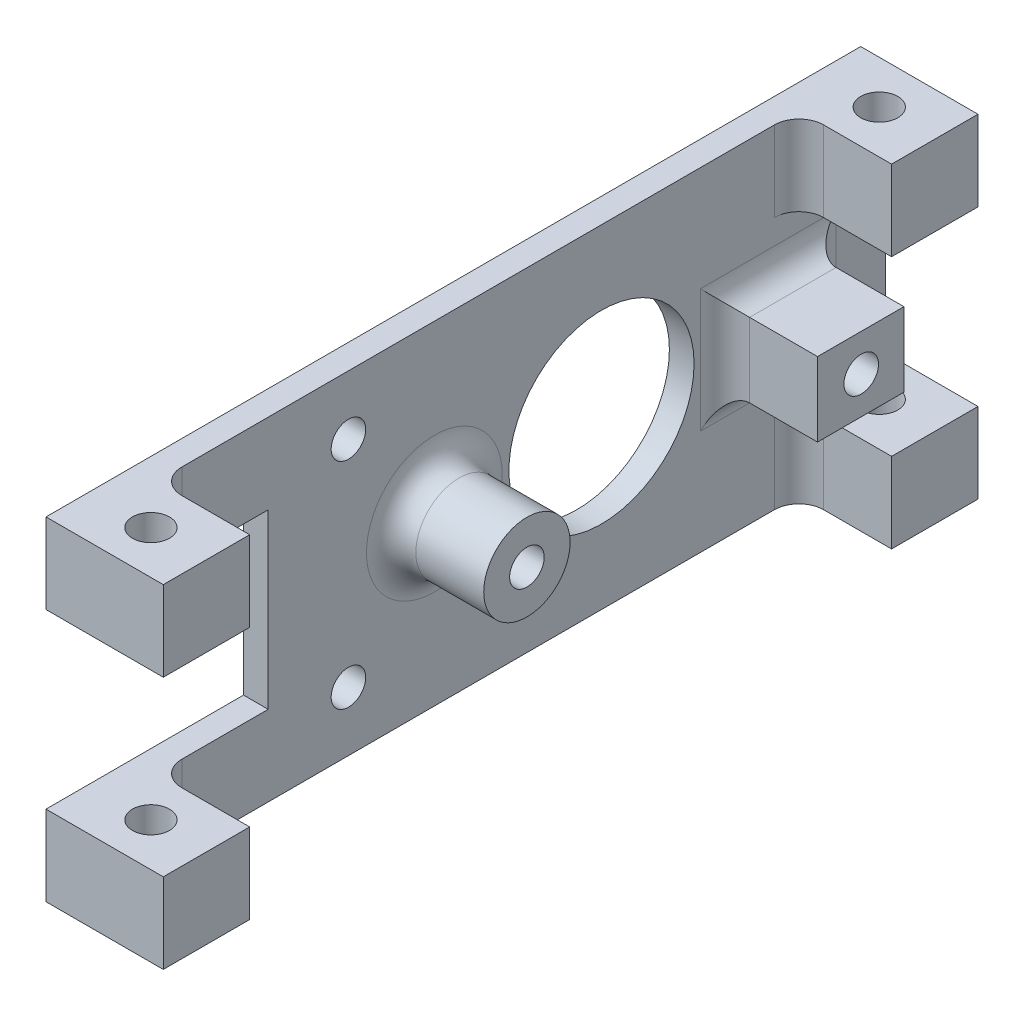
from build123d import *

# Parameters (mm, degrees)
SKETCH1_W           = 66
SKETCH1_H           = 27
BOSS_EXTRUDE1_DEPTH = 2
SKETCH2_R           = 7.5
CUT_EXTRUDE1_DEPTH  = 2
BOSS_EXTRUDE2_DEPTH = 7.5
SKETCH4_R           = 1.5
CUT_EXTRUDE2_DEPTH  = 31
SKETCH5_R           = 1.4
CUT_EXTRUDE3_DEPTH  = 31
SKETCH6_W           = 7
SKETCH6_H           = 27
BOSS_EXTRUDE3_DEPTH = 7.5
SKETCH7_R           = 1.5
CUT_EXTRUDE4_DEPTH  = 33.5
SKETCH8_W           = 16
SKETCH8_H           = 14
CUT_EXTRUDE5_DEPTH  = 15.75
SKETCH9_R           = 1.4
CUT_EXTRUDE6_DEPTH  = 31.5
SKETCH10_R          = 3.5
BOSS_EXTRUDE4_DEPTH = 7.5
SKETCH11_R          = 1.4
CUT_EXTRUDE7_DEPTH  = 9.5
CUT_EXTRUDE8_DEPTH  = 7.5
FILLET1_R           = 2


with BuildPart() as part:
    # Sketch1 → Boss-Extrude1 (new body)
    with BuildSketch(Plane(origin=(0, 0, 0), x_dir=(0, 0, -1), z_dir=(1, 0, 0))):
        Rectangle(SKETCH1_W, SKETCH1_H)
    extrude(amount=BOSS_EXTRUDE1_DEPTH)

    # Sketch2 → Cut-Extrude1 (cut)
    with BuildSketch(Plane(origin=(2, 0, 0), x_dir=(0, 0, -1), z_dir=(1, 0, 0))):
        with Locations((10, 0)):
            Circle(SKETCH2_R)
    extrude(amount=-CUT_EXTRUDE1_DEPTH, mode=Mode.SUBTRACT)

    # Sketch3 → Boss-Extrude2 (add)
    with BuildSketch(Plane(origin=(2, 0, 0), x_dir=(0, 0, -1), z_dir=(1, 0, 0))):
        Polygon((33, 13.5), (26, 13.5), (26, 3), (20, 3), (20, -3), (26, -3), (26, -13.5), (33, -13.5), align=None)
    extrude(amount=BOSS_EXTRUDE2_DEPTH)

    # Sketch4 → Cut-Extrude2 (cut)
    with BuildSketch(Plane(origin=(0, 13.5, 0), x_dir=(1, 0, 0), z_dir=(0, 1, 0))):
        with Locations(Location((5, 29.5, 0), (0, 0, 270))):
            Circle(SKETCH4_R)
    extrude(amount=-CUT_EXTRUDE2_DEPTH, mode=Mode.SUBTRACT)

    # Sketch5 → Cut-Extrude3 (cut)
    with BuildSketch(Plane(origin=(9.5, 0, 0), x_dir=(0, 0, -1), z_dir=(1, 0, 0))):
        with Locations((23.54, 0)):
            Circle(SKETCH5_R)
    extrude(amount=-CUT_EXTRUDE3_DEPTH, mode=Mode.SUBTRACT)

    # Sketch6 → Boss-Extrude3 (add)
    with BuildSketch(Plane(origin=(2, 0, 0), x_dir=(0, 0, -1), z_dir=(1, 0, 0))):
        with Locations((-29.5, 0)):
            Rectangle(SKETCH6_W, SKETCH6_H)
    extrude(amount=BOSS_EXTRUDE3_DEPTH)

    # Sketch7 → Cut-Extrude4 (cut)
    with BuildSketch(Plane(origin=(0, 13.5, 0), x_dir=(1, 0, 0), z_dir=(0, 1, 0))):
        with Locations(Location((5, -29.5, 0), (0, 0, 270))):
            Circle(SKETCH7_R)
    extrude(amount=-CUT_EXTRUDE4_DEPTH, mode=Mode.SUBTRACT)

    # Sketch8 → Cut-Extrude5 (cut, symmetric)
    with BuildSketch(Plane(origin=(2, 0, 0), x_dir=(0, 0, -1), z_dir=(1, 0, 0))):
        with Locations((-25, 0)):
            Rectangle(SKETCH8_W, SKETCH8_H)
    extrude(amount=CUT_EXTRUDE5_DEPTH, both=True, mode=Mode.SUBTRACT)

    # Sketch9 → Cut-Extrude6 (cut)
    with BuildSketch(Plane(origin=(2, 0, 0), x_dir=(0, 0, -1), z_dir=(1, 0, 0))):
        with Locations((-10.5, -8.7)):
            Circle(SKETCH9_R)
    cut_extrude6 = extrude(amount=-CUT_EXTRUDE6_DEPTH, mode=Mode.SUBTRACT)

    # Mirror1: Cut-Extrude6 across plane
    add(cut_extrude6.mirror(Plane.ZX), mode=Mode.SUBTRACT)

    # Sketch10 → Boss-Extrude4 (add)
    with BuildSketch(Plane(origin=(2, 0, 0), x_dir=(0, 0, -1), z_dir=(1, 0, 0))):
        with Locations(Location((-3.54, 0, 0), (0, 0, 180))):
            Circle(SKETCH10_R)
    extrude(amount=BOSS_EXTRUDE4_DEPTH)

    # Sketch11 → Cut-Extrude7 (cut)
    with BuildSketch(Plane(origin=(9.5, 0, 0), x_dir=(0, 0, -1), z_dir=(1, 0, 0))):
        with Locations((-3.54, 0)):
            Circle(SKETCH11_R)
    extrude(amount=-CUT_EXTRUDE7_DEPTH, mode=Mode.SUBTRACT)

    # Sketch12 → Cut-Extrude8 (cut)
    with BuildSketch(Plane(origin=(9.5, 0, 0), x_dir=(0, 0, -1), z_dir=(1, 0, 0))):
        Polygon((26, -7), (33, -7), (33, -3), (33, 3), (33, 7), (26, 7), (26, 3), (27, 3), (27, -3), (26, -3), align=None)
    extrude(amount=-CUT_EXTRUDE8_DEPTH, mode=Mode.SUBTRACT)

    # Fillet1
    fillet1_edges = [part.edges().sort_by_distance(p)[0] for p in [
        (2, 0, 0.04),
        (2, -10.25, 26),
        (2, -10.25, -26),
        (2, 0, -20),
        (2, -3, -23.5),
        (2, 3, -23.5),
        (2, 10.25, -26),
        (2, 10.25, 26),
        (2, 0, -27),
    ]]
    fillet(fillet1_edges, radius=FILLET1_R)


solid = part.part
